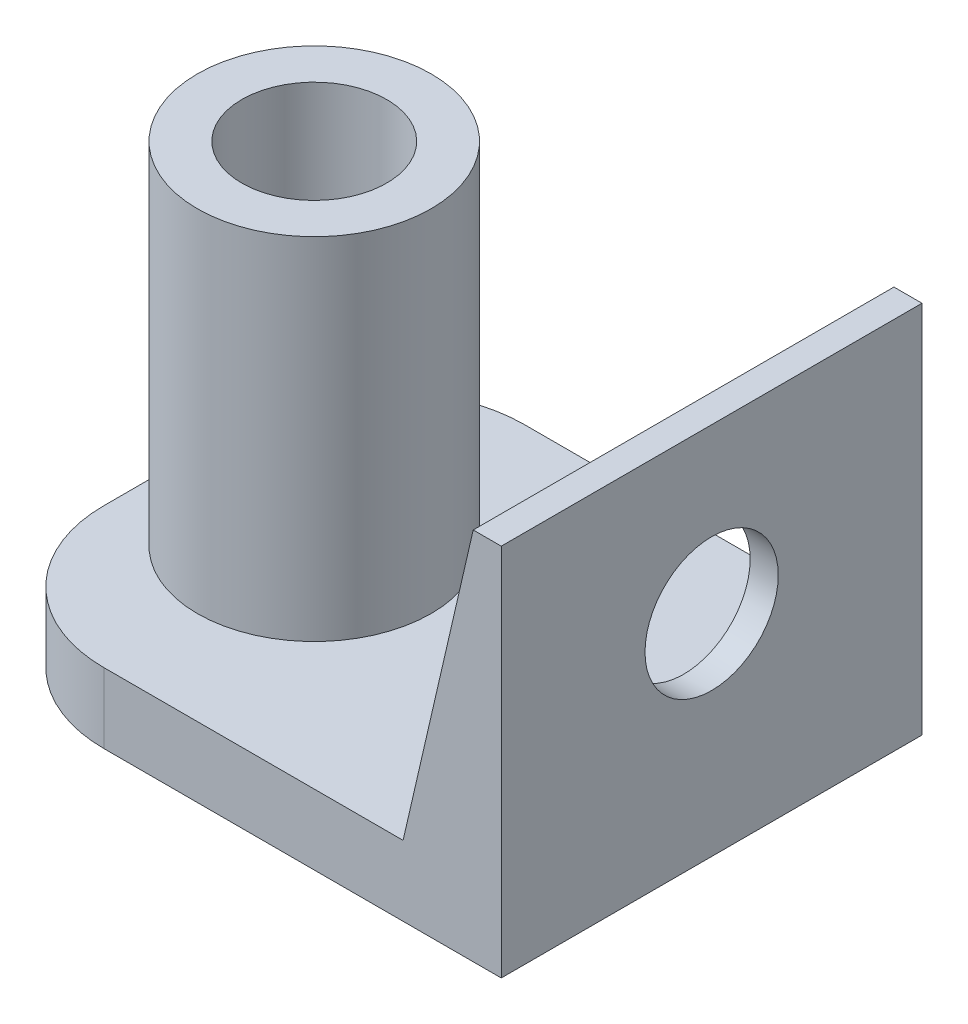
from build123d import *
from build123d.topology import SkipClean

# Parameters (mm, degrees)
BOSS_EXTRU_1_DEPTH           = 18
ENL_V_MAT_EXTRU_1_DEPTH      = 34.301651611
ENL_V_MAT_EXTRU_1_DEPTH_BACK = 34.301651611
ESQUISSE2_R                  = 2.85
ENL_V_MAT_EXTRU_2_DEPTH      = 34.301651611
ENL_V_MAT_EXTRU_2_DEPTH_BACK = 34.301651611
ESQUISSE3_R                  = 2.7
BOSS_EXTRU_2_DEPTH           = 3
BOSS_EXTRU_3_START           = -18
BOSS_EXTRU_3_DEPTH           = 3
CONG_1_R                     = 6
ESQUISSE6_R                  = 5
ESQUISSE6_R_2                = 3.1
BOSS_EXTRU_4_DEPTH           = 15
ESQUISSE7_R                  = 3.1
ESQUISSE7_R_2                = 2.7
BOSS_EXTRU_5_DEPTH           = 7


with BuildPart() as part:
    # Esquisse1 → Boss.-Extru.1 (new body)
    with BuildSketch(Plane.XY):
        Polygon((0, 0), (23, 0), (23, 16), (21.8, 16), (21.8, 3), (0, 3), align=None)
    extrude(amount=BOSS_EXTRU_1_DEPTH)

    # Esquisse2 → Enlèv. mat.-Extru.1 (cut, two sides: drawn at the far end of the back side and taken through both)
    with BuildSketch(Plane(origin=(23, 0, 0), x_dir=(0, 0, -1), z_dir=(1, 0, 0)).offset(-ENL_V_MAT_EXTRU_1_DEPTH_BACK)):
        with Locations((-9, 9)):
            Circle(ESQUISSE2_R)
    extrude(amount=ENL_V_MAT_EXTRU_1_DEPTH + ENL_V_MAT_EXTRU_1_DEPTH_BACK, mode=Mode.SUBTRACT)

    # Esquisse3 → Enlèv. mat.-Extru.2 (cut, two sides: drawn at the far end of the back side and taken through both)
    with BuildSketch(Plane.XZ.offset(-ENL_V_MAT_EXTRU_2_DEPTH_BACK)):
        with Locations((6, 9)):
            Circle(ESQUISSE3_R)
    extrude(amount=ENL_V_MAT_EXTRU_2_DEPTH + ENL_V_MAT_EXTRU_2_DEPTH_BACK, mode=Mode.SUBTRACT)

    # Esquisse4 → Boss.-Extru.2 (add)
    with BuildSketch(Plane.XY.offset(18)):
        Polygon((21.8, 3), (21.8, 16), (18.8, 3), align=None)
    extrude(amount=-BOSS_EXTRU_2_DEPTH)

    # Esquisse4<2> → Boss.-Extru.3 (add)
    with BuildSketch(Plane.XY.offset(18).offset(BOSS_EXTRU_3_START)):
        Polygon((21.8, 3), (21.8, 16), (18.8, 3), align=None)
    extrude(amount=BOSS_EXTRU_3_DEPTH)

    # Congé1
    cong_1_edges = [part.edges().sort_by_distance(p)[0] for p in [
        (0, 1.5, 18),
        (0, 1.5, 0),
    ]]
    fillet(cong_1_edges, radius=CONG_1_R)

    # Esquisse6 → Boss.-Extru.4 (add)
    with BuildSketch(Plane(origin=(0, 3, 0), x_dir=(1, 0, 0), z_dir=(0, 1, 0))):
        with Locations((6, -9)):
            Circle(ESQUISSE6_R)
        with Locations(Location((6, -9, 0), (0, 0, 180))):
            Circle(ESQUISSE6_R_2, mode=Mode.SUBTRACT)
    extrude(amount=BOSS_EXTRU_4_DEPTH)

    # Esquisse7 → Boss.-Extru.5 (add)
    with SkipClean():  # the faces are left unmerged after this step: merging them gives an invalid solid
        with BuildSketch(Plane(origin=(0, 3, 0), x_dir=(1, 0, 0), z_dir=(0, 1, 0))):
            with Locations(Location((6, -9, 0), (0, 0, 180))):
                Circle(ESQUISSE7_R)
            with Locations(Location((6, -9, 0), (0, 0, 180))):
                Circle(ESQUISSE7_R_2, mode=Mode.SUBTRACT)
        extrude(amount=BOSS_EXTRU_5_DEPTH)


solid = part.part
